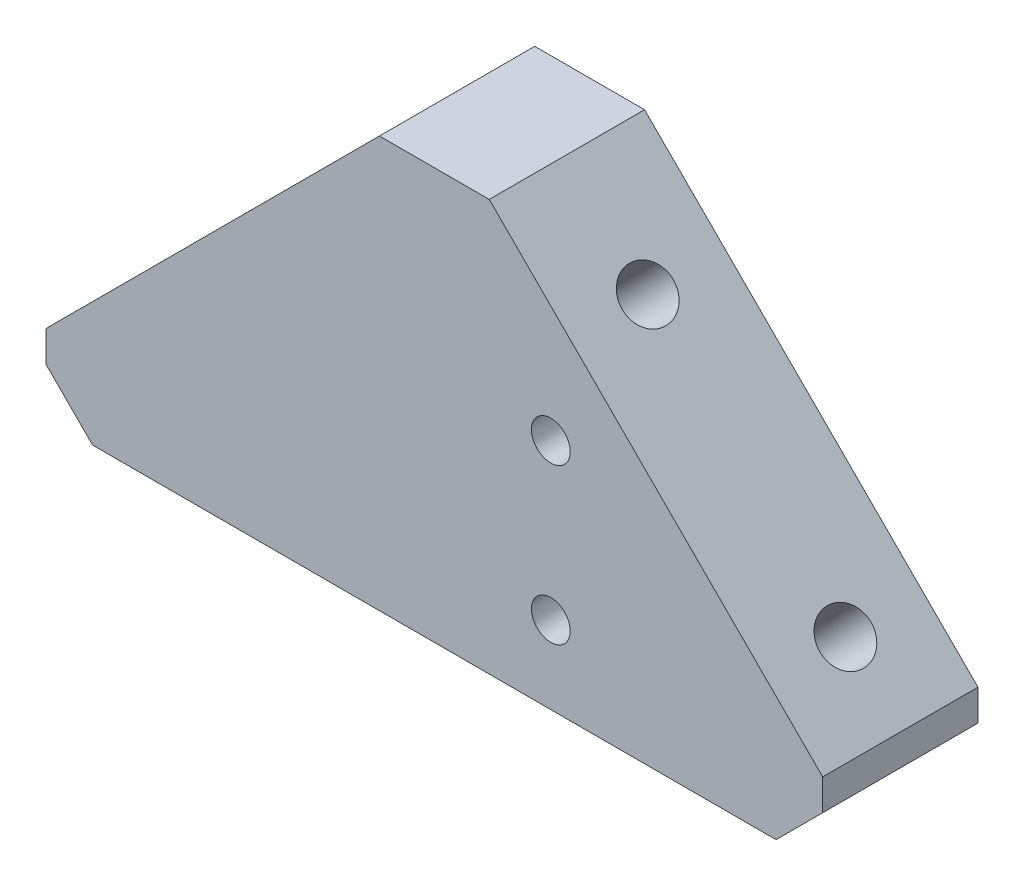
from build123d import *

# Parameters (mm, degrees)
BOSS_EXTRU_1_DEPTH      = 10
ESQUISSE2_R             = 1.65
ENL_V_MAT_EXTRU_1_DEPTH = 8
ESQUISSE3_R             = 1.65
ENL_V_MAT_EXTRU_2_DEPTH = 8
CHANFREIN1_SIZE         = 5
ESQUISSE4_R             = 1.65
ENL_V_MAT_EXTRU_3_DEPTH = 10
CHANFREIN3_SIZE         = 3
ESQUISSE5_R             = 1.25
ENL_V_MAT_EXTRU_4_DEPTH = 38.754045686


with BuildPart() as part:
    # Esquisse1 → Boss.-Extru.1 (new body)
    with BuildSketch(Plane.XY):
        Polygon((-25, 0), (25, 0), (25, 5), (0, 30), (-25, 5), align=None)
    extrude(amount=BOSS_EXTRU_1_DEPTH)

    # Esquisse2 → Enlèv. mat.-Extru.1 (cut)
    with BuildSketch(Plane(origin=(15, 15, 0), x_dir=(0, 0, -1), z_dir=(0.7071067811865511, 0.7071067811865439, 0))):
        with Locations(Location((-5, 8.857864376, 0), (0, 0, 90))):
            Circle(ESQUISSE2_R)
        with Locations(Location((-5, -9.142135624, 0), (0, 0, 90))):
            Circle(ESQUISSE2_R)
    extrude(amount=-ENL_V_MAT_EXTRU_1_DEPTH, mode=Mode.SUBTRACT)

    # Esquisse3 → Enlèv. mat.-Extru.2 (cut)
    with BuildSketch(Plane(origin=(-15, 15, 0), x_dir=(0, 0, 1), z_dir=(-0.7071067811865511, 0.7071067811865439, 0))):
        with Locations(Location((5, 9.857864376, 0), (0, 0, 270))):
            Circle(ESQUISSE3_R)
        with Locations(Location((5, -8.142135624, 0), (0, 0, 270))):
            Circle(ESQUISSE3_R)
    extrude(amount=-ENL_V_MAT_EXTRU_2_DEPTH, mode=Mode.SUBTRACT)

    # Chanfrein1
    chanfrein1_edges = [part.edges().sort_by_distance(p)[0] for p in [
        (0, 30, 5),
    ]]
    chamfer(chanfrein1_edges, length=CHANFREIN1_SIZE)

    # Esquisse4 → Enlèv. mat.-Extru.3 (cut)
    with BuildSketch(Plane.XZ):
        with Locations(Location((0, 5, 0), (0, 0, 270))):
            Circle(ESQUISSE4_R)
        with Locations(Location((-16, 5, 0), (0, 0, 270))):
            Circle(ESQUISSE4_R)
        with Locations(Location((16, 5, 0), (0, 0, 90))):
            Circle(ESQUISSE4_R)
    extrude(amount=-ENL_V_MAT_EXTRU_3_DEPTH, mode=Mode.SUBTRACT)

    # Chanfrein3
    chanfrein3_edges = [part.edges().sort_by_distance(p)[0] for p in [
        (25, 0, 5),
        (-25, 0, 5),
    ]]
    chamfer(chanfrein3_edges, length=CHANFREIN3_SIZE)

    # Esquisse5 → Enlèv. mat.-Extru.4 (cut, through all)
    with BuildSketch(Plane.XY.offset(10)):
        with Locations((7.5, 15)):
            Circle(ESQUISSE5_R)
        with Locations((7.5, 5)):
            Circle(ESQUISSE5_R)
    extrude(amount=-ENL_V_MAT_EXTRU_4_DEPTH, mode=Mode.SUBTRACT)


solid = part.part
